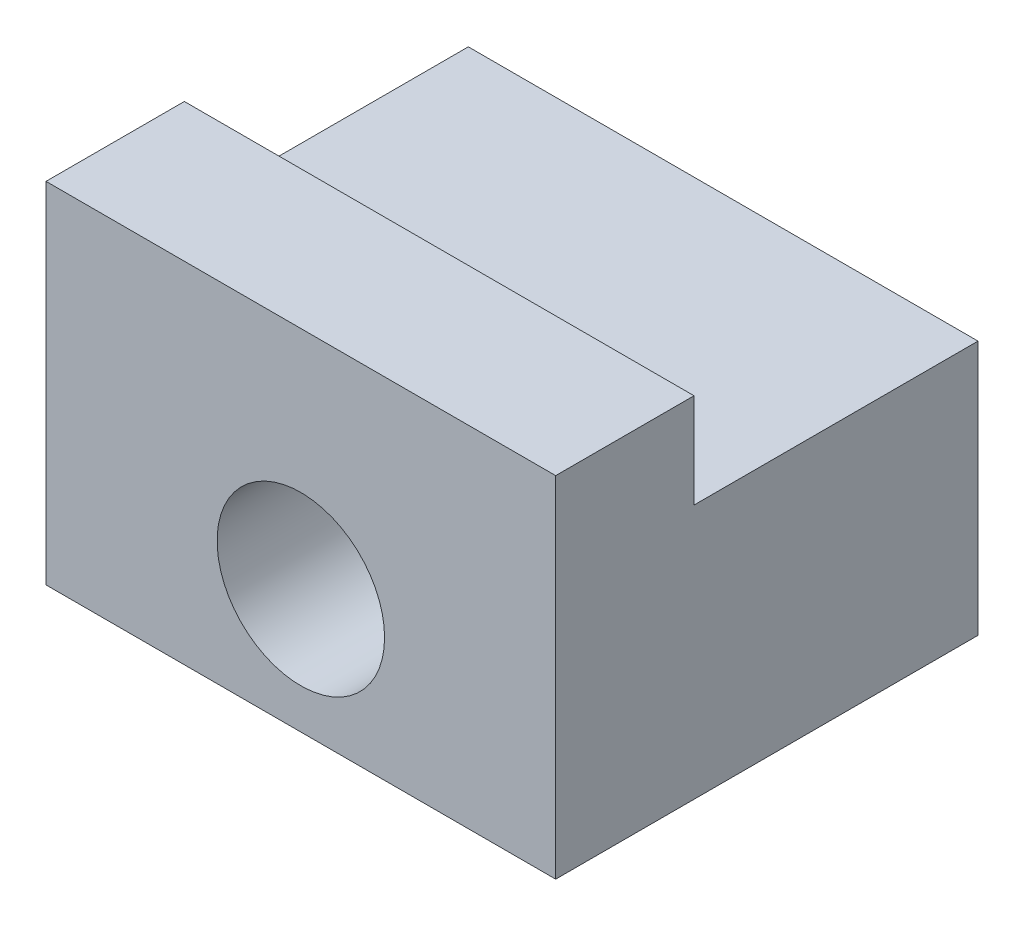
from build123d import *

# Parameters (mm, degrees)
M2_SCREW_CLIP_BODY_PROFILE_W       = 7
M2_SCREW_CLIP_BODY_PROFILE_H       = 3.5
M2_SCREW_CLIP_BODY_PROFILE_R       = 1.15
M2_SCREW_CLIP_BODY_DEPTH           = 5.8
BOARD_START                        = 3.9
BOARD_EDGE_RETAINING_TOE_PROFILE_W = 7
BOARD_EDGE_RETAINING_TOE_PROFILE_H = 1.3
BOARD_EDGE_RETAINING_TOE_DEPTH     = 1.9


with BuildPart() as part:
    # M2 screw clip body profile → M2 screw clip body (new body)
    with BuildSketch(Plane.XY):
        with Locations((0, 0.05)):
            Rectangle(M2_SCREW_CLIP_BODY_PROFILE_W, M2_SCREW_CLIP_BODY_PROFILE_H)
        Circle(M2_SCREW_CLIP_BODY_PROFILE_R, mode=Mode.SUBTRACT)
    extrude(amount=M2_SCREW_CLIP_BODY_DEPTH)

    # Board edge retaining toe profile → Board edge retaining toe (add)
    with BuildSketch(Plane.XY.offset(BOARD_START)):
        with Locations((0, 2.45)):
            Rectangle(BOARD_EDGE_RETAINING_TOE_PROFILE_W, BOARD_EDGE_RETAINING_TOE_PROFILE_H)
    extrude(amount=BOARD_EDGE_RETAINING_TOE_DEPTH)


solid = part.part
